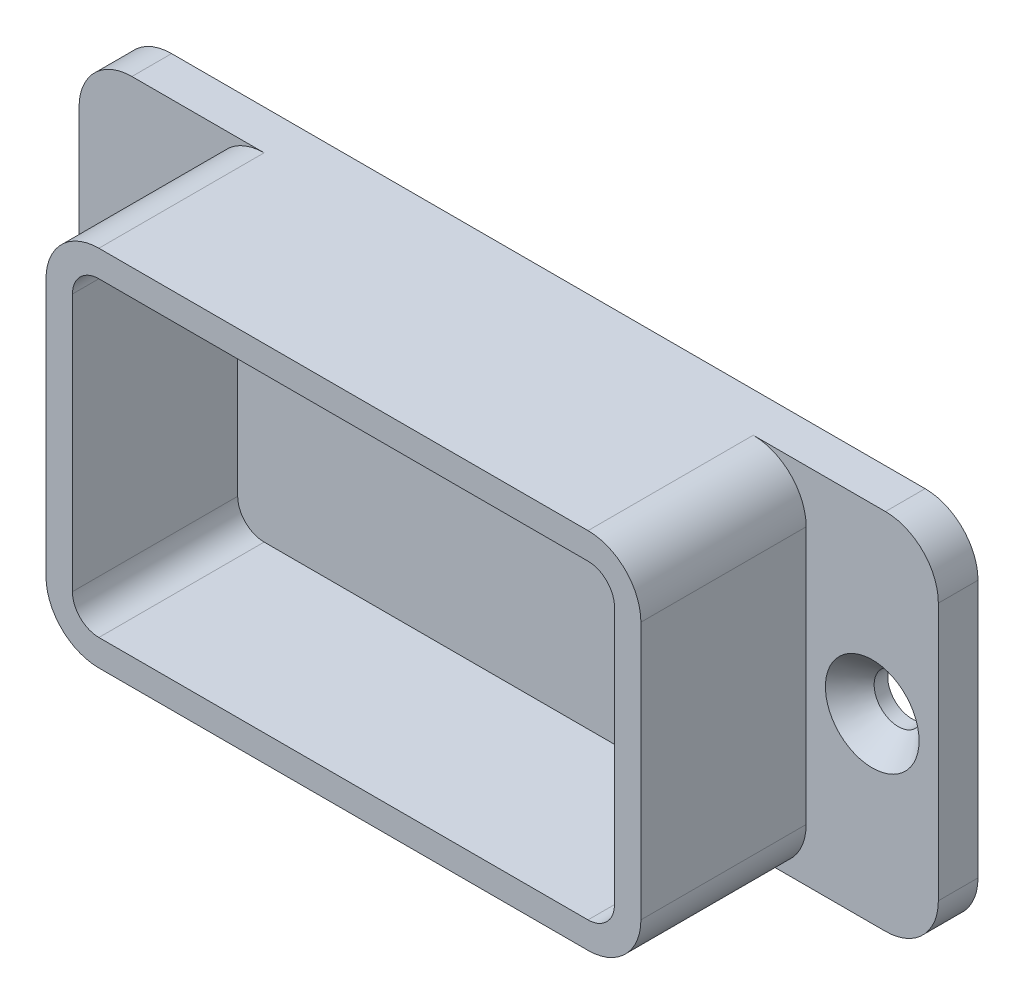
from build123d import *

# Parameters (mm, degrees)
WALLS_SKETCH_W                 = 45
WALLS_SKETCH_H                 = 27.5
WALLS_SKETCH_W_2               = 41
WALLS_SKETCH_H_2               = 23.5
WALLS_EXTRUDE_DEPTH            = 15.5
BASE_SKETCH_W                  = 65
BASE_SKETCH_H                  = 27.5
BASE_EXTRUDE_DEPTH             = 3
NO_6_MOUNTING_HOLES_AT_2_COUNT = 2
NO_6_MOUNTING_HOLES_AT_2_PITCH = 55
TAB_FILLETS_R                  = 4
INSIDE_CORNER_FILLETS_R        = 2
OUTSIDE_CORNER_FILLETS_R       = 4


with BuildPart() as part:
    # Walls Sketch → Walls Extrude (new body)
    with BuildSketch(Plane.XY.offset(-2.5)):
        Rectangle(WALLS_SKETCH_W, WALLS_SKETCH_H)
        Rectangle(WALLS_SKETCH_W_2, WALLS_SKETCH_H_2, mode=Mode.SUBTRACT)
    extrude(amount=WALLS_EXTRUDE_DEPTH)

    # Base Sketch → Base Extrude (add)
    with BuildSketch(Plane.XY.offset(-2.5)):
        Rectangle(BASE_SKETCH_W, BASE_SKETCH_H)
    extrude(amount=BASE_EXTRUDE_DEPTH)

    # No. 6 Mounting Holes Profile Sketch → No. 6 Mounting Holes (revolve, cut)
    with BuildSketch(Plane(origin=(-27.5, 0, 0.5), x_dir=(0, -1, 0), z_dir=(1, 0, 0))):
        Polygon((0, 0), (0, 3), (1.8288, 3), (1.8288, 1.972306634), (3.5433, 0), align=None)
    no_6_mounting_holes = revolve(axis=Axis((-27.5, 0, 6.85), (0, 0, -1)), mode=Mode.SUBTRACT)

    # No. 6 Mounting Holes at 2: No. 6 Mounting Holes ×2
    with Locations(*[(i * NO_6_MOUNTING_HOLES_AT_2_PITCH, 0, 0) for i in range(1, NO_6_MOUNTING_HOLES_AT_2_COUNT)]):
        add(no_6_mounting_holes, mode=Mode.SUBTRACT)

    # Tab Fillets
    tab_fillets_edges = [part.edges().sort_by_distance(p)[0] for p in [
        (-32.5, -13.75, -1),
        (32.5, 13.75, -1),
        (-32.5, 13.75, -1),
        (32.5, -13.75, -1),
    ]]
    fillet(tab_fillets_edges, radius=TAB_FILLETS_R)

    # Inside Corner Fillets
    inside_corner_fillets_edges = [part.edges().sort_by_distance(p)[0] for p in [
        (-20.5, -11.75, 6.75),
        (20.5, -11.75, 6.75),
        (-20.5, 11.75, 6.75),
        (20.5, 11.75, 6.75),
    ]]
    fillet(inside_corner_fillets_edges, radius=INSIDE_CORNER_FILLETS_R)

    # Outside Corner Fillets
    outside_corner_fillets_edges = [part.edges().sort_by_distance(p)[0] for p in [
        (22.5, -13.75, 6.75),
        (-22.5, -13.75, 6.75),
        (-22.5, 13.75, 6.75),
        (22.5, 13.75, 6.75),
    ]]
    fillet(outside_corner_fillets_edges, radius=OUTSIDE_CORNER_FILLETS_R)


solid = part.part
